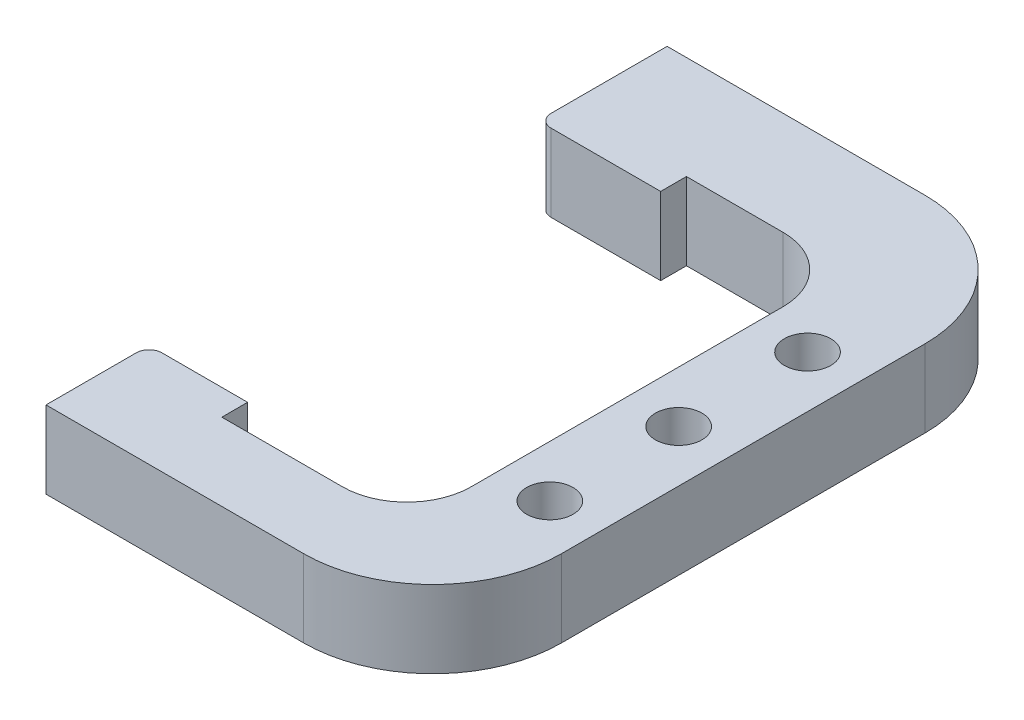
from build123d import *

# Parameters (mm, degrees)
SALIENTE_EXTRUIR1_DEPTH = 6
REDONDEO1_R             = 10
REDONDEO2_R             = 5
REDONDEO3_R             = 1
CROQUIS2_R              = 1.803309478
CORTAR_EXTRUIR1_DEPTH   = 6
MATRIZL1_COUNT          = 2
MATRIZL1_PITCH          = 10
MATRIZL2_COUNT          = 2
MATRIZL2_PITCH          = 10


with BuildPart() as part:
    # Croquis1 → Saliente-Extruir1 (new body)
    with BuildSketch(Plane(origin=(0, 0, 0), x_dir=(1, 0, 0), z_dir=(0, 1, 0))):
        Polygon((0, -36.6), (0, -28.6), (7.646653433, -28.6), (7.646653433, -30.6), (22, -30.6), (22, -28.6), (22, 1.6), (22, 3.6), (9.500929434, 3.6), (9.500929434, 1.6), (0, 1.6), (0, 11.6), (30, 11.6), (30, -36.6), align=None)
    extrude(amount=SALIENTE_EXTRUIR1_DEPTH)

    # Redondeo1
    redondeo1_edges = [part.edges().sort_by_distance(p)[0] for p in [
        (30, 3, -11.6),
        (30, 3, 36.6),
    ]]
    fillet(redondeo1_edges, radius=REDONDEO1_R)

    # Redondeo2
    redondeo2_edges = [part.edges().sort_by_distance(p)[0] for p in [
        (22, 3, 30.6),
        (22, 3, -3.6),
    ]]
    fillet(redondeo2_edges, radius=REDONDEO2_R)

    # Redondeo3
    redondeo3_edges = [part.edges().sort_by_distance(p)[0] for p in [
        (0, 3, 28.6),
        (0, 3, -1.6),
    ]]
    fillet(redondeo3_edges, radius=REDONDEO3_R)

    # Croquis2 → Cortar-Extruir1 (cut)
    with BuildSketch(Plane(origin=(0, 6, 0), x_dir=(1, 0, 0), z_dir=(0, 1, 0))):
        with Locations(Location((26, -13.5, 0), (0, 0, 270))):
            Circle(CROQUIS2_R)
    cortar_extruir1 = extrude(amount=-CORTAR_EXTRUIR1_DEPTH, mode=Mode.SUBTRACT)

    # MatrizL1: Cortar-Extruir1 ×2
    with Locations(*[(0, 0, i * MATRIZL1_PITCH) for i in range(1, MATRIZL1_COUNT)]):
        add(cortar_extruir1, mode=Mode.SUBTRACT)

    # MatrizL2: Cortar-Extruir1 ×2
    with Locations(*[(0, 0, -i * MATRIZL2_PITCH) for i in range(1, MATRIZL2_COUNT)]):
        add(cortar_extruir1, mode=Mode.SUBTRACT)


solid = part.part
